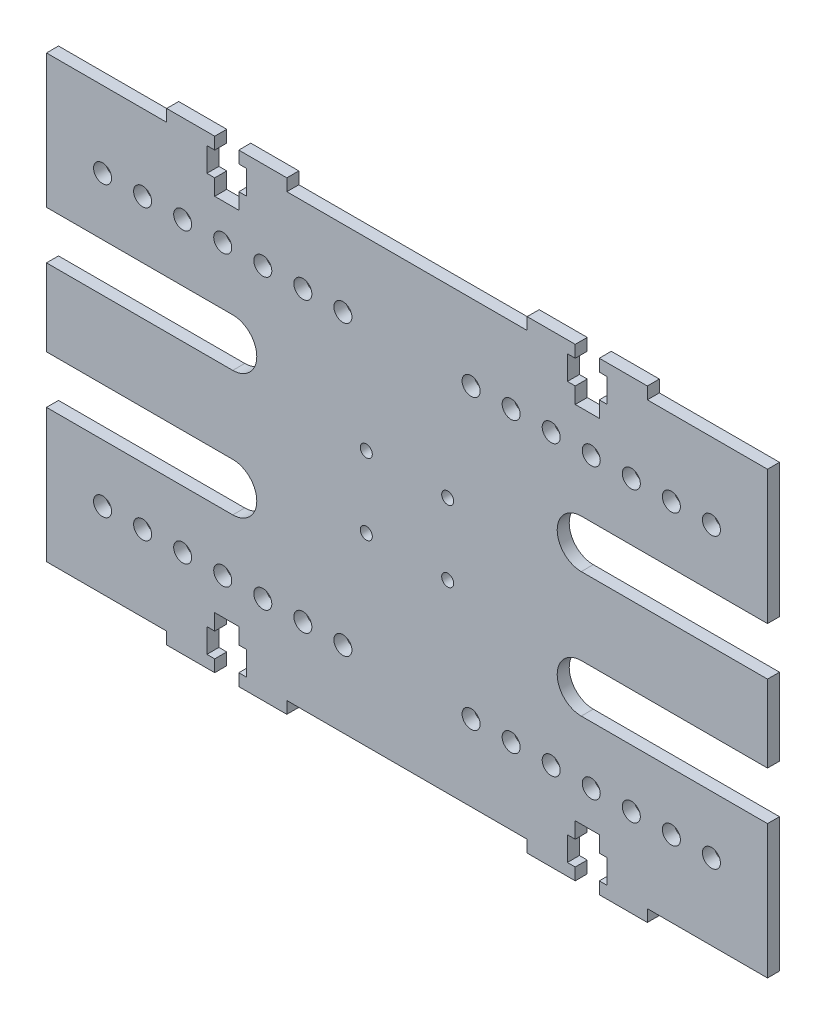
from build123d import *

# Parameters (mm, degrees)
SKETCH1_R             = 2.25
PLATE_THICKNESS_DEPTH = 3
EXTRUDE_2_DEPTH       = 3
SKETCH_2_3_W          = 6
SKETCH_2_3_H          = 6
SKETCH_2_3_H_2        = 2
SKETCH_2_3_W_2        = 1.95
SKETCH_2_3_H_3        = 2.000000003
SKETCH_2_3_H_4        = 1.999999997
SKETCH_2_3_H_5        = 6.000000001
CUT_EXTRUDE_1_DEPTH   = 3


with BuildPart() as part:
    # Sketch1 → Plate_thickness (new body)
    with BuildSketch(Plane.XY):
        with BuildLine():
            Line((-90, -47), (-90, -21.621))
            Line((-90, -21.621), (-43.5, -21.621))
            ThreePointArc((-43.5, -21.621), (-37.5, -15.621), (-43.5, -9.621))
            Line((-43.5, -9.621), (-90, -9.621))
            Line((-90, -9.621), (-90, 9.621))
            Line((-90, 9.621), (-43.5, 9.621))
            ThreePointArc((-43.5, 9.621), (-37.5, 15.621), (-43.5, 21.621))
            Line((-43.5, 21.621), (-90, 21.621))
            Line((-90, 21.621), (-90, 46.999999997))
            ThreePointArc((-90, 46.999999997), (-89.121320344, 49.12132034), (-87, 49.999999997))
            Line((-87, 49.999999997), (87, 49.999999997))
            ThreePointArc((87, 49.999999997), (89.121320345, 49.12132034), (90.000000002, 46.999999995))
            Line((90.000000002, 46.999999995), (90.000000002, 21.621))
            Line((90.000000002, 21.621), (43.5, 21.621))
            ThreePointArc((43.5, 21.621), (37.5, 15.621), (43.5, 9.621))
            Line((43.5, 9.621), (90, 9.621))
            Line((90, 9.621), (90, -9.621))
            Line((90, -9.621), (43.5, -9.621))
            ThreePointArc((43.5, -9.621), (37.5, -15.621), (43.5, -21.621))
            Line((43.5, -21.621), (90, -21.621))
            Line((90, -21.621), (90, -47))
            ThreePointArc((90, -47), (89.121320344, -49.121320344), (87, -50))
            Line((87, -50), (-87, -50))
            ThreePointArc((-87, -50), (-89.121320344, -49.121320344), (-90, -47))
        make_face()
        with Locations((-76, -36)):
            Circle(SKETCH1_R, mode=Mode.SUBTRACT)
        with Locations((-66, -36)):
            Circle(SKETCH1_R, mode=Mode.SUBTRACT)
        with Locations((-56, -36)):
            Circle(SKETCH1_R, mode=Mode.SUBTRACT)
        with Locations((-46, -36)):
            Circle(SKETCH1_R, mode=Mode.SUBTRACT)
        with Locations((-36, -36)):
            Circle(SKETCH1_R, mode=Mode.SUBTRACT)
        with Locations((-26, -36)):
            Circle(SKETCH1_R, mode=Mode.SUBTRACT)
        with Locations((-16, -36)):
            Circle(SKETCH1_R, mode=Mode.SUBTRACT)
        with Locations((16, -36)):
            Circle(SKETCH1_R, mode=Mode.SUBTRACT)
        with Locations((26, -36)):
            Circle(SKETCH1_R, mode=Mode.SUBTRACT)
        with Locations((36, -36)):
            Circle(SKETCH1_R, mode=Mode.SUBTRACT)
        with Locations((46, -36)):
            Circle(SKETCH1_R, mode=Mode.SUBTRACT)
        with Locations((56, -36)):
            Circle(SKETCH1_R, mode=Mode.SUBTRACT)
        with Locations((66, -36)):
            Circle(SKETCH1_R, mode=Mode.SUBTRACT)
        with Locations((76, -36)):
            Circle(SKETCH1_R, mode=Mode.SUBTRACT)
        with Locations((-76, 36)):
            Circle(SKETCH1_R, mode=Mode.SUBTRACT)
        with Locations((-66, 36)):
            Circle(SKETCH1_R, mode=Mode.SUBTRACT)
        with Locations((-56, 36)):
            Circle(SKETCH1_R, mode=Mode.SUBTRACT)
        with Locations((-46, 36)):
            Circle(SKETCH1_R, mode=Mode.SUBTRACT)
        with Locations((-36, 36)):
            Circle(SKETCH1_R, mode=Mode.SUBTRACT)
        with Locations((-26, 36)):
            Circle(SKETCH1_R, mode=Mode.SUBTRACT)
        with Locations((-16, 36)):
            Circle(SKETCH1_R, mode=Mode.SUBTRACT)
        with Locations((16, 36)):
            Circle(SKETCH1_R, mode=Mode.SUBTRACT)
        with Locations((26, 36)):
            Circle(SKETCH1_R, mode=Mode.SUBTRACT)
        with Locations((36, 36)):
            Circle(SKETCH1_R, mode=Mode.SUBTRACT)
        with Locations((46, 36)):
            Circle(SKETCH1_R, mode=Mode.SUBTRACT)
        with Locations((56, 36)):
            Circle(SKETCH1_R, mode=Mode.SUBTRACT)
        with Locations((66, 36)):
            Circle(SKETCH1_R, mode=Mode.SUBTRACT)
        with Locations((76, 36)):
            Circle(SKETCH1_R, mode=Mode.SUBTRACT)
    extrude(amount=PLATE_THICKNESS_DEPTH)

    # 草图2 → 凸台-拉伸2 (add)
    with BuildSketch(Plane.XY.offset(3)):
        Polygon((-90, 54.999999997), (-90, 46.999999997), (-48, 46.999999997), (-48, 48.999999997), (-49.95, 48.999999997), (-49.95, 54.999999997), (-60, 54.999999997), align=None)
        Polygon((-42, 48.999999997), (-42, 46.999999997), (0, 46.999999997), (42, 46.999999997), (42, 48.999999997), (40.05, 48.999999997), (40.05, 54.999999997), (30, 54.999999997), (-30, 54.999999997), (-40.05, 54.999999997), (-40.05, 48.999999997), align=None)
        Polygon((-42, 57.999999997), (-42, 54.999999997), (-40.05, 54.999999997), (-30, 54.999999997), (-30, 57.999999997), align=None)
        Polygon((-60, 57.999999997), (-60, 54.999999997), (-49.95, 54.999999997), (-48, 54.999999997), (-48, 57.999999997), align=None)
        Polygon((48, 48.999999997), (48, 46.999999997), (90, 46.999999997), (90, 54.999999997), (60, 54.999999997), (49.95, 54.999999997), (49.95, 48.999999997), align=None)
        Polygon((48, 57.999999997), (48, 54.999999997), (49.95, 54.999999997), (60, 54.999999997), (60, 57.999999997), align=None)
        Polygon((40.05, 54.999999997), (42, 54.999999997), (42, 57.999999997), (30, 57.999999997), (30, 54.999999997), align=None)
        Polygon((42, -47), (0, -47), (-42, -47), (-42, -48.999999997), (-40.05, -48.999999997), (-40.05, -54.999999997), (-30, -55), (30, -55), (40.05, -55), (40.05, -48.999999997), (42, -48.999999997), align=None)
        Polygon((90, -47), (48, -47), (48, -48.999999997), (49.95, -48.999999997), (49.95, -54.999999997), (60, -55), (90, -55), align=None)
        Polygon((-48, -48.999999997), (-48, -47), (-90, -47), (-90, -55), (-60, -55), (-49.95, -55), (-49.95, -48.999999997), align=None)
        Polygon((-48, -57.999999997), (-48, -54.999999998), (-49.95, -55), (-60, -55), (-60, -57.999999997), align=None)
        Polygon((-40.05, -55), (-42, -55), (-42, -57.999999997), (-30, -57.999999997), (-30, -54.999999997), align=None)
        Polygon((42, -57.999999997), (42, -54.999999998), (40.05, -55), (30, -55), (30, -57.999999997), align=None)
        Polygon((49.95, -55), (48, -55), (48, -57.999999997), (60, -57.999999997), (60, -54.999999997), align=None)
    extrude(amount=-EXTRUDE_2_DEPTH)

    # 草图2<3> → 切除-拉伸1 (cut)
    with BuildSketch(Plane.XY.offset(3)):
        with Locations((-45, 51.999999997)):
            Rectangle(SKETCH_2_3_W, SKETCH_2_3_H)
        with Locations((-45, 47.999999997)):
            Rectangle(SKETCH_2_3_W, SKETCH_2_3_H_2)
        with Locations((-45, 45.999999997)):
            Rectangle(SKETCH_2_3_W, SKETCH_2_3_H_2)
        with Locations((-41.025, 51.999999997)):
            Rectangle(SKETCH_2_3_W_2, SKETCH_2_3_H)
        with Locations((-48.975, 51.999999997)):
            Rectangle(SKETCH_2_3_W_2, SKETCH_2_3_H)
        with Locations((41.025, 51.999999997)):
            Rectangle(SKETCH_2_3_W_2, SKETCH_2_3_H)
        with Locations((45, 51.999999997)):
            Rectangle(SKETCH_2_3_W, SKETCH_2_3_H)
        with Locations((48.975, 51.999999997)):
            Rectangle(SKETCH_2_3_W_2, SKETCH_2_3_H)
        with Locations((45, 47.999999997)):
            Rectangle(SKETCH_2_3_W, SKETCH_2_3_H_2)
        with Locations((45, 45.999999997)):
            Rectangle(SKETCH_2_3_W, SKETCH_2_3_H_2)
        with Locations((45, -45.999999999)):
            Rectangle(SKETCH_2_3_W, SKETCH_2_3_H_3)
        with Locations((45, -47.999999999)):
            Rectangle(SKETCH_2_3_W, SKETCH_2_3_H_4)
        Polygon((48, -48.999999997), (42, -48.999999997), (42, -54.999999998), (48, -55), align=None)
        Polygon((42, -54.999999998), (42, -48.999999997), (40.05, -48.999999997), (40.05, -54.999999997), align=None)
        Polygon((49.95, -48.999999997), (48, -48.999999997), (48, -54.999999998), (49.95, -55), align=None)
        with Locations((-45, -45.999999999)):
            Rectangle(SKETCH_2_3_W, SKETCH_2_3_H_3)
        with Locations((-45, -47.999999999)):
            Rectangle(SKETCH_2_3_W, SKETCH_2_3_H_4)
        with Locations((-45, -51.999999998)):
            Rectangle(SKETCH_2_3_W, SKETCH_2_3_H_5)
        Polygon((-48, -54.999999998), (-48, -48.999999997), (-49.95, -48.999999997), (-49.95, -54.999999997), align=None)
        Polygon((-40.05, -48.999999997), (-42, -48.999999997), (-42, -54.999999998), (-40.05, -55), align=None)
        with BuildLine():
            ThreePointArc((-10.16, 7.39), (-9.099339828, 7.829339828), (-8.66, 8.89))
            Line((-8.66, 8.89), (-10.16, 8.89))
            Line((-10.16, 8.89), (-10.16, 7.39))
        make_face()
        with BuildLine():
            Line((-10.16, 8.89), (-8.66, 8.89))
            ThreePointArc((-8.66, 8.89), (-11.220660172, 9.950660172), (-10.16, 7.39))
            Line((-10.16, 7.39), (-10.16, 8.89))
        make_face()
        with BuildLine():
            ThreePointArc((11.66, 8.89), (10.16, 10.39), (8.66, 8.89))
            Line((8.66, 8.89), (10.16, 8.89))
            Line((10.16, 8.89), (10.16, 7.39))
            ThreePointArc((10.16, 7.39), (11.220660172, 7.829339828), (11.66, 8.89))
        make_face()
        with BuildLine():
            Line((10.16, 8.89), (8.66, 8.89))
            ThreePointArc((8.66, 8.89), (9.099339828, 7.829339828), (10.16, 7.39))
            Line((10.16, 7.39), (10.16, 8.89))
        make_face()
        with BuildLine():
            ThreePointArc((10.16, -7.39), (9.099339828, -7.829339828), (8.66, -8.89))
            Line((8.66, -8.89), (10.16, -8.89))
            Line((10.16, -8.89), (10.16, -7.39))
        make_face()
        with BuildLine():
            Line((10.16, -8.89), (8.66, -8.89))
            ThreePointArc((8.66, -8.89), (10.16, -10.39), (11.66, -8.89))
            ThreePointArc((11.66, -8.89), (11.220660172, -7.829339828), (10.16, -7.39))
            Line((10.16, -7.39), (10.16, -8.89))
        make_face()
        with BuildLine():
            ThreePointArc((-10.16, -7.39), (-11.220660172, -9.950660172), (-8.66, -8.89))
            Line((-8.66, -8.89), (-10.16, -8.89))
            Line((-10.16, -8.89), (-10.16, -7.39))
        make_face()
        with BuildLine():
            Line((-10.16, -8.89), (-8.66, -8.89))
            ThreePointArc((-8.66, -8.89), (-9.099339828, -7.829339828), (-10.16, -7.39))
            Line((-10.16, -7.39), (-10.16, -8.89))
        make_face()
    extrude(amount=-CUT_EXTRUDE_1_DEPTH, mode=Mode.SUBTRACT)


solid = part.part
